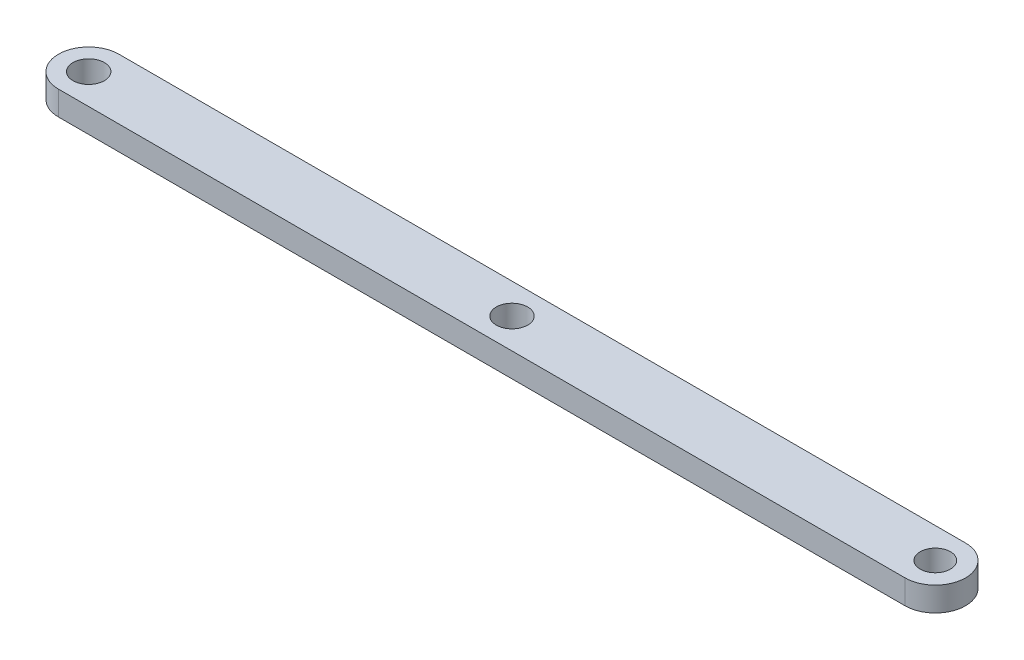
from build123d import *

# Parameters (mm, degrees)
BOSS_EXTRUDE1_DEPTH = 2.54
SKETCH2_R           = 1.651
SKETCH2_R_2         = 1.5875
CUT_EXTRUDE1_DEPTH  = 2.54
SKETCH3_R           = 1.651
CUT_EXTRUDE2_DEPTH  = 2.54


with BuildPart() as part:
    # Sketch1 → Boss-Extrude1 (new body)
    with BuildSketch(Plane(origin=(0, 0, 0), x_dir=(1, 0, 0), z_dir=(0, 1, 0))):
        with BuildLine():
            ThreePointArc((-57.992346939, -7.386734694), (-58.922282909, -5.141670664), (-61.167346939, -4.211734694))
            Line((-61.167346939, -4.211734694), (-61.167346939, -10.561734694))
            ThreePointArc((-61.167346939, -10.561734694), (-58.922282909, -9.631798724), (-57.992346939, -7.386734694))
        make_face()
        with BuildLine():
            Line((-61.167346939, -10.561734694), (-61.167346939, -4.211734694))
            ThreePointArc((-61.167346939, -4.211734694), (-64.342346939, -7.386734694), (-61.167346939, -10.561734694))
        make_face()
        with BuildLine():
            Line((27.732653061, -4.211734694), (-61.167346939, -4.211734694))
            ThreePointArc((-61.167346939, -4.211734694), (-58.922282909, -5.141670664), (-57.992346939, -7.386734694))
            ThreePointArc((-57.992346939, -7.386734694), (-58.922282909, -9.631798724), (-61.167346939, -10.561734694))
            Line((-61.167346939, -10.561734694), (27.732653061, -10.561734694))
            ThreePointArc((27.732653061, -10.561734694), (24.557653061, -7.386734694), (27.732653061, -4.211734694))
        make_face()
        with BuildLine():
            ThreePointArc((30.907653061, -7.386734694), (29.977717091, -5.141670664), (27.732653061, -4.211734694))
            Line((27.732653061, -4.211734694), (27.732653061, -10.561734694))
            ThreePointArc((27.732653061, -10.561734694), (29.977717091, -9.631798724), (30.907653061, -7.386734694))
        make_face()
        with BuildLine():
            Line((27.732653061, -10.561734694), (27.732653061, -4.211734694))
            ThreePointArc((27.732653061, -4.211734694), (24.557653061, -7.386734694), (27.732653061, -10.561734694))
        make_face()
    extrude(amount=BOSS_EXTRUDE1_DEPTH)

    # Sketch2 → Cut-Extrude1 (cut)
    with BuildSketch(Plane(origin=(0, 2.54, 0), x_dir=(1, 0, 0), z_dir=(0, 1, 0))):
        with Locations(Location((-61.167346939, -7.386734694, 0), (0, 0, 270))):
            Circle(SKETCH2_R)
        with Locations(Location((27.732653061, -7.386734694, 0), (0, 0, 270))):
            Circle(SKETCH2_R_2)
    extrude(amount=-CUT_EXTRUDE1_DEPTH, mode=Mode.SUBTRACT)

    # Sketch3 → Cut-Extrude2 (cut)
    with BuildSketch(Plane(origin=(0, 2.54, 0), x_dir=(1, 0, 0), z_dir=(0, 1, 0))):
        with Locations(Location((-16.717346939, -7.386734694, 0), (0, 0, 270))):
            Circle(SKETCH3_R)
    extrude(amount=-CUT_EXTRUDE2_DEPTH, mode=Mode.SUBTRACT)


solid = part.part
